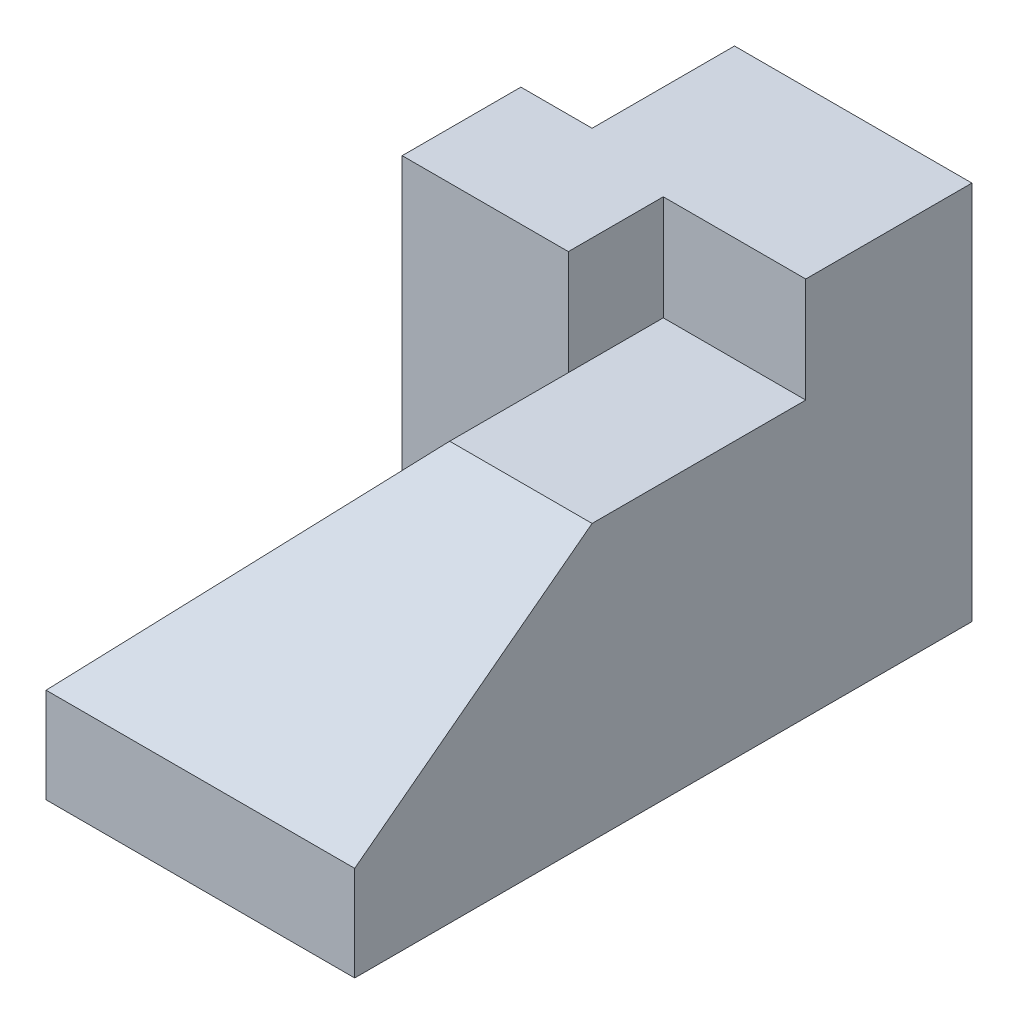
from build123d import *

# Parameters (mm, degrees)
BOSS_EXTRUDE1_DEPTH = 20
BOSS_EXTRUDE2_DEPTH = 80
BOSS_EXTRUDE6_DEPTH = 30
BOSS_EXTRUDE7_DEPTH = 75
CUT_EXTRUDE1_REACH  = 158.605


with BuildPart() as part:
    # Sketch1 → Boss-Extrude1 (new body)
    with BuildSketch(Plane(origin=(0, 0, 0), x_dir=(1, 0, 0), z_dir=(0, 1, 0))):
        Polygon((35, 75), (0, 75), (0, 0), (65, 0), (65, 95), (35, 95), align=None)
    extrude(amount=BOSS_EXTRUDE1_DEPTH)

    # Sketch1<3> → Boss-Extrude2 (add)
    with BuildSketch(Plane(origin=(0, 0, 0), x_dir=(1, 0, 0), z_dir=(0, 1, 0))):
        Polygon((15, 130), (15, 100), (0, 100), (0, 75), (35, 75), (35, 95), (65, 95), (65, 100), (65, 130), align=None)
    extrude(amount=BOSS_EXTRUDE2_DEPTH)

    # Sketch8 → Boss-Extrude6 (add)
    with BuildSketch(Plane(origin=(65, 0, 0), x_dir=(0, 0, -1), z_dir=(1, 0, 0))):
        Polygon((95, 57.913643311), (50, 57.913643311), (0, 20), (95, 20), align=None)
    extrude(amount=-BOSS_EXTRUDE6_DEPTH)

    # Sketch9 → Boss-Extrude7 (add)
    with BuildSketch(Plane.XY.offset(-75)):
        Polygon((0, 20), (35, 57.913643311), (35, 20), align=None)
    extrude(amount=BOSS_EXTRUDE7_DEPTH)

    # Sketch10 → Cut-Extrude1 (cut, up to next)
    with BuildSketch(Plane(origin=(35, 0, 0), x_dir=(0, 0, -1), z_dir=(1, 0, 0)), mode=Mode.PRIVATE) as cut_extrude1_sk1:
        Polygon((0, 57.913643311), (50, 57.913643311), (0, 20), align=None)
    cut_extrude1_tool1 = extrude(cut_extrude1_sk1.sketch, amount=-CUT_EXTRUDE1_REACH, mode=Mode.PRIVATE) & part.part
    add(cut_extrude1_tool1.solids().sort_by_distance((35, 45.275762, -16.666667))[0], mode=Mode.SUBTRACT)


solid = part.part
